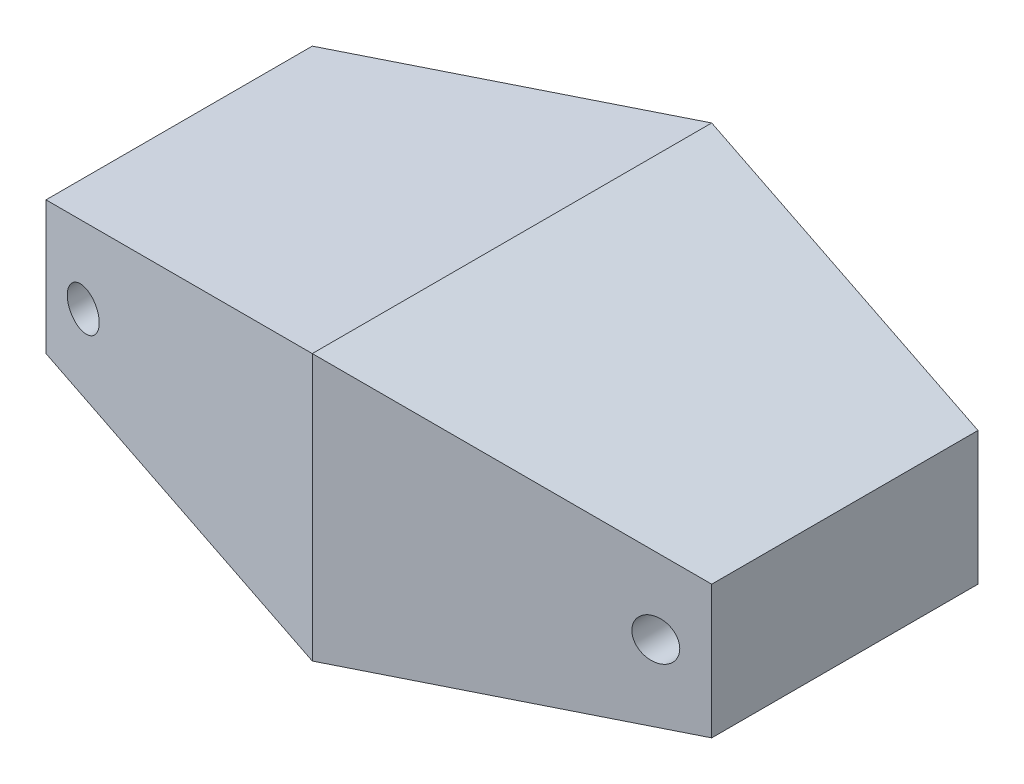
from build123d import *

# Parameters (mm, degrees)
SKETCH1_W           = 100
SKETCH1_H           = 40
BOSS_EXTRUDE1_DEPTH = 60
CUT_EXTRUDE1_DEPTH  = 40
CUT_EXTRUDE2_DEPTH  = 81.622577483
SKETCH5_R           = 3
CUT_EXTRUDE3_DEPTH  = 81.622577483


with BuildPart() as part:
    # Sketch1 → Boss-Extrude1 (new body)
    with BuildSketch(Plane.XY):
        Rectangle(SKETCH1_W, SKETCH1_H)
    extrude(amount=BOSS_EXTRUDE1_DEPTH)

    # Sketch2 → Cut-Extrude1 (cut)
    with BuildSketch(Plane(origin=(0, 20, 0), x_dir=(1, 0, 0), z_dir=(0, 1, 0))):
        Polygon((0, -60), (-50, -50), (-50, -60), align=None)
        Polygon((50, -50), (0, -60), (50, -60), align=None)
        Polygon((50, 0), (0, 0), (50, -10), align=None)
        Polygon((-50, 0), (-50, -10), (0, 0), align=None)
    extrude(amount=-CUT_EXTRUDE1_DEPTH, mode=Mode.SUBTRACT)

    # Sketch4 → Cut-Extrude2 (cut, through all)
    with BuildSketch(Plane.XY):
        Polygon((-50, 20), (0, 20), (-50, 10), align=None)
        Polygon((50, 20), (50, 10), (0, 20), align=None)
        Polygon((50, -20), (0, -20), (50, -10), align=None)
        Polygon((-50, -10), (-50, -20), (0, -20), align=None)
    extrude(amount=CUT_EXTRUDE2_DEPTH, mode=Mode.SUBTRACT)

    # Sketch5 → Cut-Extrude3 (cut, through all)
    with BuildSketch(Plane.XY):
        with Locations(Location((-43, 0, 0), (0, 0, 180))):
            Circle(SKETCH5_R)
        with Locations(Location((43, 0, 0), (0, 0, 180))):
            Circle(SKETCH5_R)
    extrude(amount=CUT_EXTRUDE3_DEPTH, mode=Mode.SUBTRACT)


solid = part.part
